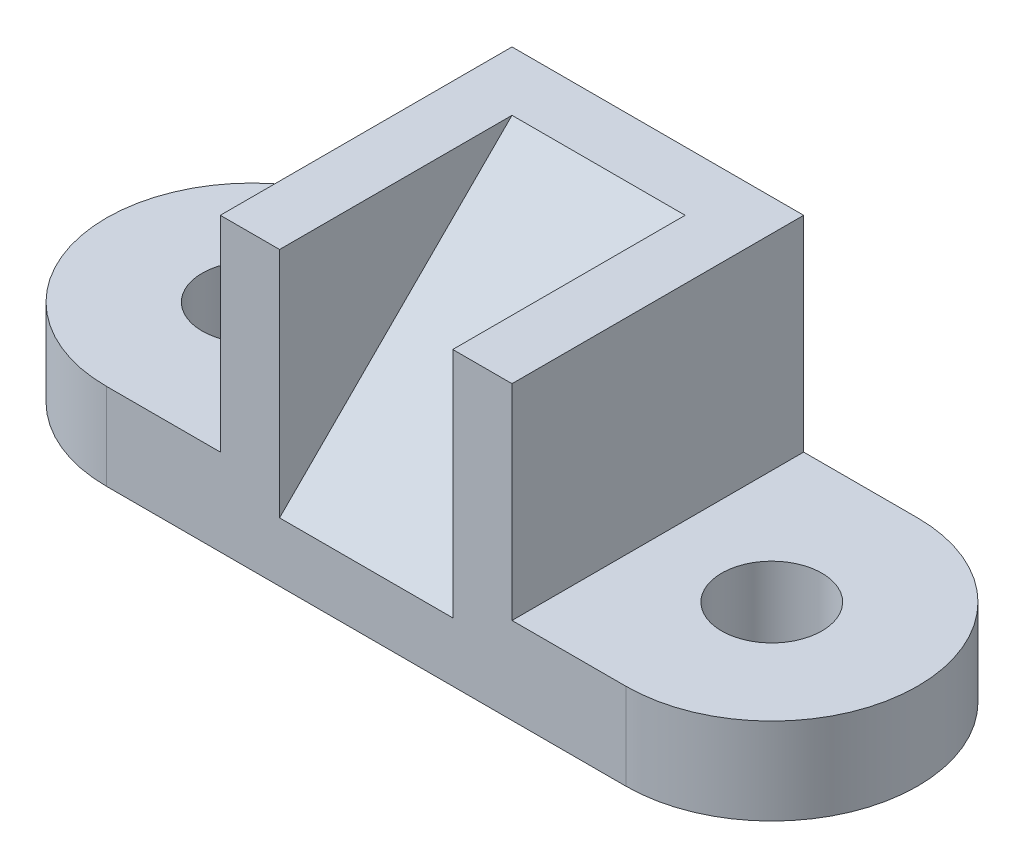
from build123d import *

# Parameters (mm, degrees)
SKETCH1_R           = 11
BOSS_EXTRUDE1_DEPTH = 19
SKETCH2_W           = 64
SKETCH2_H           = 64
BOSS_EXTRUDE2_DEPTH = 45
CUT_EXTRUDE1_START  = -13
CUT_EXTRUDE1_DEPTH  = 38


with BuildPart() as part:
    # Sketch1 → Boss-Extrude1 (new body)
    with BuildSketch(Plane(origin=(0, 0, 0), x_dir=(1, 0, 0), z_dir=(0, 1, 0))):
        with BuildLine():
            Line((-57, 32), (57, 32))
            ThreePointArc((57, 32), (89, 0), (57, -32))
            Line((57, -32), (-57, -32))
            ThreePointArc((-57, -32), (-89, 0), (-57, 32))
        make_face()
        with Locations(Location((-57, 0, 0), (0, 0, 270))):
            Circle(SKETCH1_R, mode=Mode.SUBTRACT)
        with Locations(Location((57, 0, 0), (0, 0, 270))):
            Circle(SKETCH1_R, mode=Mode.SUBTRACT)
    extrude(amount=BOSS_EXTRUDE1_DEPTH)

    # Sketch2 → Boss-Extrude2 (add)
    with BuildSketch(Plane(origin=(0, 19, 0), x_dir=(1, 0, 0), z_dir=(0, 1, 0))):
        Rectangle(SKETCH2_W, SKETCH2_H)
    extrude(amount=BOSS_EXTRUDE2_DEPTH)

    # Sketch3 → Cut-Extrude1 (cut)
    with BuildSketch(Plane.ZY.offset(32).offset(CUT_EXTRUDE1_START)):
        Polygon((32, 64), (-19, 64), (32, 13), align=None)
    extrude(amount=-CUT_EXTRUDE1_DEPTH, mode=Mode.SUBTRACT)


solid = part.part
